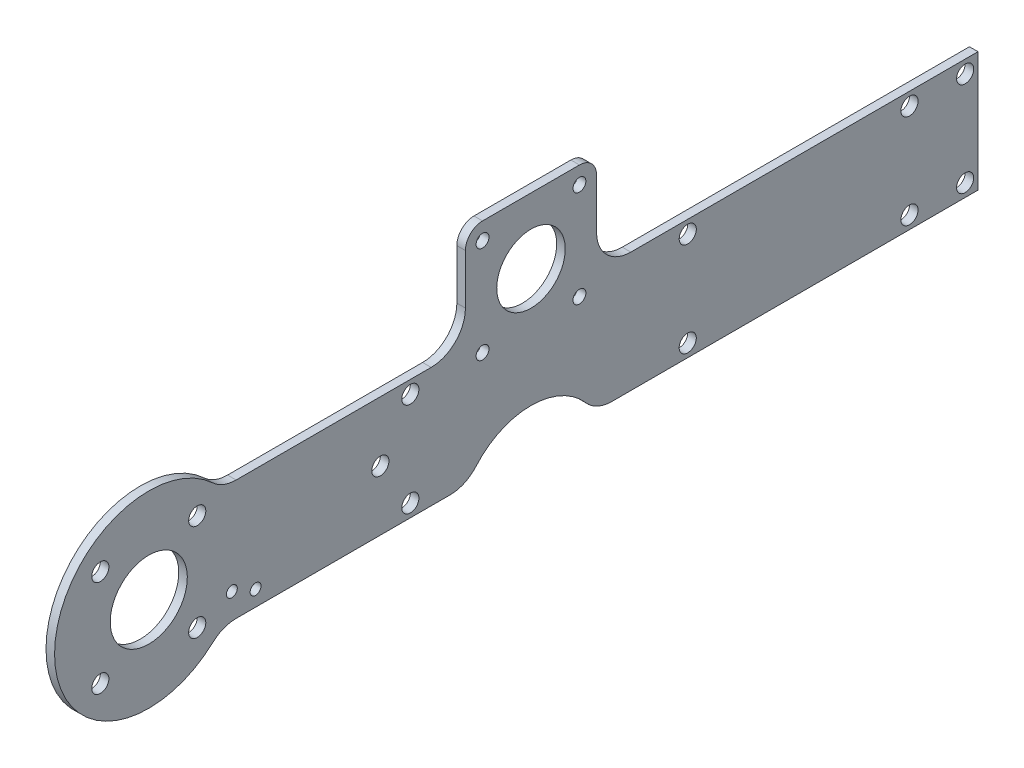
from build123d import *

# Parameters (mm, degrees)
SKETCH1_R           = 3.175
SKETCH1_R_2         = 2.38125
SKETCH1_R_3         = 12.7
SKETCH1_R_4         = 3.175000001
SKETCH1_R_5         = 2.0193
SKETCH1_R_6         = 14.287500001
BOSS_EXTRUDE1_DEPTH = 3.175
FILLET1_R           = 12.7
FILLET2_R           = 6.35


with BuildPart() as part:
    # Sketch1 → Boss-Extrude1 (new body)
    with BuildSketch(Plane.ZY.offset(38.887083386)):
        with BuildLine():
            Line((342.127458156, 784.981140976), (200.726675, 784.981140976))
            Line((200.726675, 784.981140976), (200.726675, 740.531140976))
            Line((200.726675, 740.531140976), (342.992469809, 740.531140976))
            ThreePointArc((342.992469809, 740.531140976), (366.437970398, 754.238128734), (389.883470986, 740.531140976))
            Line((389.883470986, 740.531140976), (475.74833758, 740.531140976))
            ThreePointArc((475.74833758, 740.531140976), (480.3857219, 739.654197546), (484.382677289, 737.144474309))
            ThreePointArc((484.382677289, 737.144474309), (543.052111491, 762.756140976), (484.382677289, 788.367807643))
            ThreePointArc((484.382677289, 788.367807643), (480.3857219, 785.858084405), (475.74833758, 784.981140976))
            Line((475.74833758, 784.981140976), (390.74848264, 784.981140976))
            Line((390.74848264, 784.981140976), (390.74848264, 822.48966546))
            Line((390.74848264, 822.48966546), (342.127458156, 822.48966546))
            Line((342.127458156, 822.48966546), (342.127458156, 784.981140976))
        make_face()
        with Locations(Location((226.126675, 745.293640976, 0), (0, 0, 270))):
            Circle(SKETCH1_R, mode=Mode.SUBTRACT)
        with Locations(Location((308.3258375, 745.293640976, 0), (0, 0, 270))):
            Circle(SKETCH1_R, mode=Mode.SUBTRACT)
        with Locations(Location((226.126675, 780.218640976, 0), (0, 0, 270))):
            Circle(SKETCH1_R, mode=Mode.SUBTRACT)
        with Locations(Location((308.3258375, 780.218640976, 0), (0, 0, 270))):
            Circle(SKETCH1_R, mode=Mode.SUBTRACT)
        with Locations(Location((205.489175, 780.218640976, 0), (0, 0, 270))):
            Circle(SKETCH1_R, mode=Mode.SUBTRACT)
        with Locations(Location((205.489175, 745.293640976, 0), (0, 0, 270))):
            Circle(SKETCH1_R, mode=Mode.SUBTRACT)
        with Locations(Location((384.39848264, 780.218640976, 0), (0, 0, 270))):
            Circle(SKETCH1_R_2, mode=Mode.SUBTRACT)
        with Locations(Location((348.477458156, 780.218640976, 0), (0, 0, 270))):
            Circle(SKETCH1_R_2, mode=Mode.SUBTRACT)
        with Locations(Location((384.39848264, 816.13966546, 0), (0, 0, 270))):
            Circle(SKETCH1_R_2, mode=Mode.SUBTRACT)
        with Locations(Location((366.437970398, 798.179153218, 0), (0, 0, 270))):
            Circle(SKETCH1_R_3, mode=Mode.SUBTRACT)
        with Locations(Location((348.477458156, 816.13966546, 0), (0, 0, 270))):
            Circle(SKETCH1_R_2, mode=Mode.SUBTRACT)
        with Locations(Location((411.1625, 780.218640976, 0), (0, 0, 270))):
            Circle(SKETCH1_R, mode=Mode.SUBTRACT)
        with Locations(Location((411.1625, 745.293640976, 0), (0, 0, 270))):
            Circle(SKETCH1_R, mode=Mode.SUBTRACT)
        with Locations(Location((526.087623733, 780.716653218, 0), (0, 0, 270))):
            Circle(SKETCH1_R_4, mode=Mode.SUBTRACT)
        with Locations(Location((490.166599249, 744.795628734, 0), (0, 0, 270))):
            Circle(SKETCH1_R_4, mode=Mode.SUBTRACT)
        with Locations(Location((468.527325029, 746.353372356, 0), (0, 0, 270))):
            Circle(SKETCH1_R_5, mode=Mode.SUBTRACT)
        with Locations(Location((477.327277576, 749.998432049, 0), (0, 0, 270))):
            Circle(SKETCH1_R_5, mode=Mode.SUBTRACT)
        with Locations(Location((526.087623733, 744.795628734, 0), (0, 0, 270))):
            Circle(SKETCH1_R_4, mode=Mode.SUBTRACT)
        with Locations(Location((422.275, 762.756140976, 0), (0, 0, 270))):
            Circle(SKETCH1_R, mode=Mode.SUBTRACT)
        with Locations(Location((508.127111491, 762.756140976, 0), (0, 0, 270))):
            Circle(SKETCH1_R_6, mode=Mode.SUBTRACT)
        with Locations(Location((490.166599249, 780.716653218, 0), (0, 0, 270))):
            Circle(SKETCH1_R_4, mode=Mode.SUBTRACT)
    extrude(amount=BOSS_EXTRUDE1_DEPTH)

    # Fillet1
    fillet1_edges = [part.edges().sort_by_distance(p)[0] for p in [
        (-40.474583386, 784.981140976, 342.127458156),
        (-40.474583386, 784.981140976, 390.74848264),
        (-40.474583386, 740.531140976, 389.883470986),
        (-40.474583386, 740.531140976, 342.992469809),
    ]]
    fillet(fillet1_edges, radius=FILLET1_R)

    # Fillet2
    fillet2_edges = [part.edges().sort_by_distance(p)[0] for p in [
        (-40.474583386, 822.48966546, 342.127458156),
        (-40.474583386, 822.48966546, 390.74848264),
    ]]
    fillet(fillet2_edges, radius=FILLET2_R)


solid = part.part
